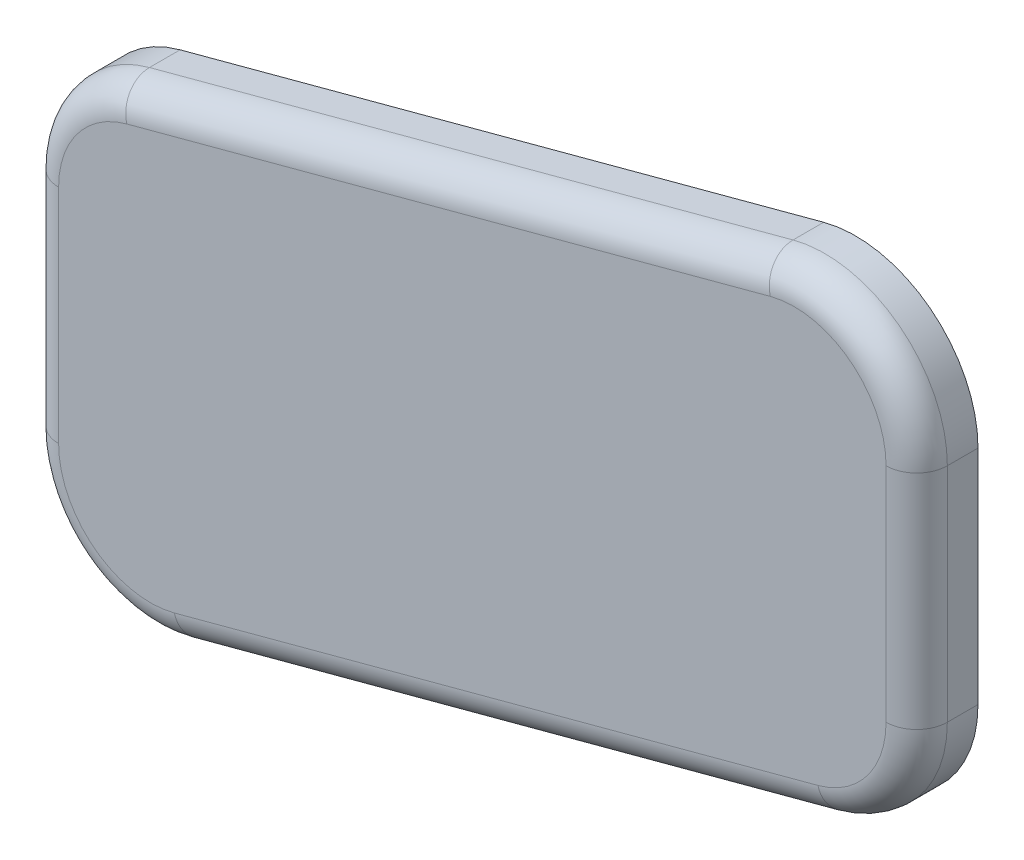
from build123d import *

# Parameters (mm, degrees)
EXTRUDE_1_DEPTH = 2
FILLET_1_R      = 4
FILLET_2_R      = 1


with BuildPart() as part:
    # Эскиз1 → Бобышка-Вытянуть1 (new body)
    with BuildSketch(Plane.XY):
        Polygon((0, 0), (29, 7.770526581), (29, 23.299669287), (0, 15.529142706), align=None)
    extrude(amount=EXTRUDE_1_DEPTH)

    # Скругление1
    fillet_1_edges = [part.edges().sort_by_distance(p)[0] for p in [
        (0, 15.529142706, 1),
        (29, 23.299669287, 1),
        (29, 7.770526581, 1),
        (0, 0, 1),
    ]]
    fillet(fillet_1_edges, radius=FILLET_1_R)

    # Скругление2
    fillet_2_edges = [part.edges().sort_by_distance(p)[0] for p in [
        (0, 8.836368123, 2),
        (13.46472382, 19.13700458, 2),
        (15.53527618, 4.162664707, 2),
        (29, 14.463301164, 2),
        (27.435045716, 21.260181156, 2),
        (28.173413361, 8.404788816, 2),
        (1.564954284, 2.03948813, 2),
        (0.826586639, 14.89488047, 2),
    ]]
    fillet(fillet_2_edges, radius=FILLET_2_R)


solid = part.part
